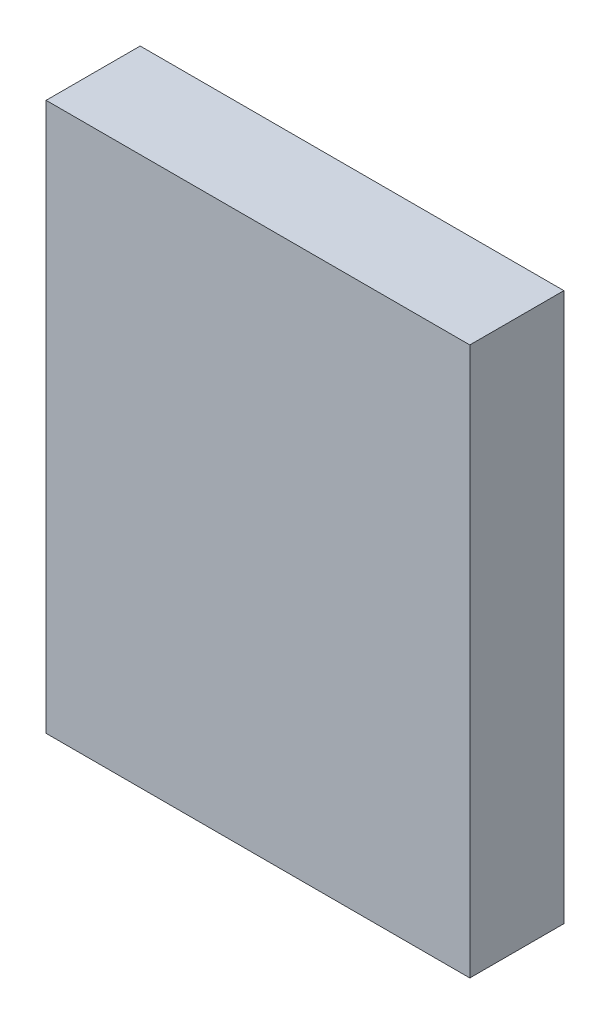
from build123d import *

# Parameters (mm, degrees)
SKETCH1_W               = 4.99999
SKETCH1_H               = 6.469634
COMPONENT_OUTLINE_DEPTH = 1.1100054


with BuildPart() as part:
    # Sketch1 → Component_Outline (new body)
    with BuildSketch(Plane.XY):
        with Locations((1.919605, 2.9024072)):
            Rectangle(SKETCH1_W, SKETCH1_H)
    extrude(amount=COMPONENT_OUTLINE_DEPTH)


solid = part.part
